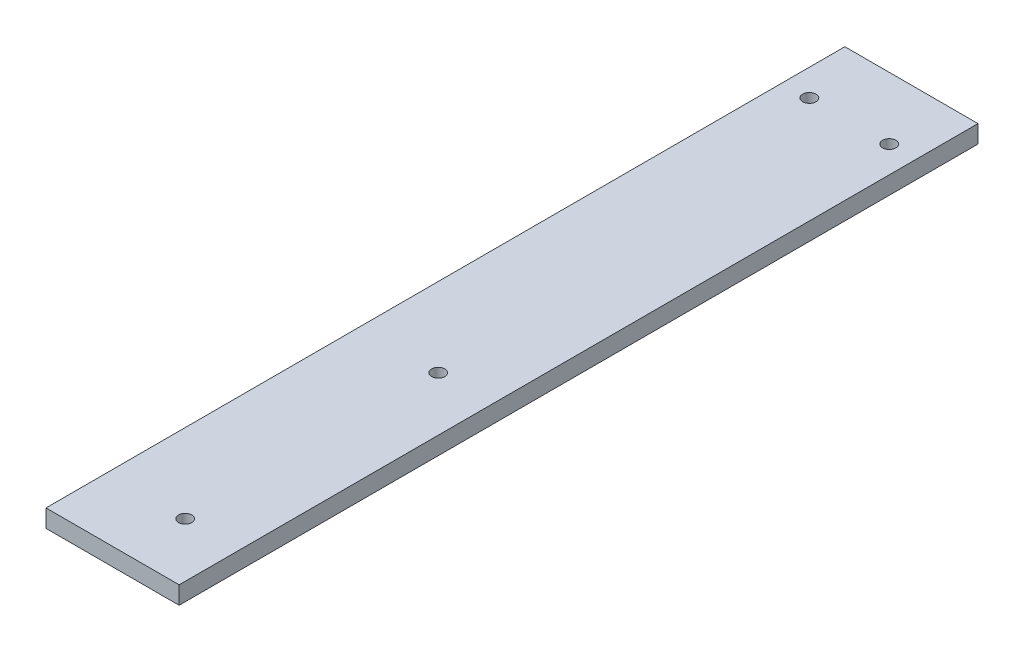
from build123d import *

# Parameters (mm, degrees)
SKETCH1_W           = 15
SKETCH1_H           = 2
BOSS_EXTRUDE1_DEPTH = 90
SKETCH3_R           = 0.75
CUT_EXTRUDE1_DEPTH  = 92.263355187


with BuildPart() as part:
    # Sketch1 → Boss-Extrude1 (new body)
    with BuildSketch(Plane.XY):
        with Locations((7.5, 1)):
            Rectangle(SKETCH1_W, SKETCH1_H)
    extrude(amount=BOSS_EXTRUDE1_DEPTH)

    # Sketch3 → Cut-Extrude1 (cut, through all)
    with BuildSketch(Plane(origin=(0, 2, 0), x_dir=(1, 0, 0), z_dir=(0, 1, 0))):
        with Locations(Location((8.9, -83.220061422, 0), (0, 0, 180))):
            Circle(SKETCH3_R)
        with Locations(Location((8.9, -54.720061422, 0), (0, 0, 180))):
            Circle(SKETCH3_R)
        with Locations(Location((12, -7, 0), (0, 0, 180))):
            Circle(SKETCH3_R)
        with Locations(Location((3, -7, 0), (0, 0, 180))):
            Circle(SKETCH3_R)
    extrude(amount=-CUT_EXTRUDE1_DEPTH, mode=Mode.SUBTRACT)


solid = part.part
